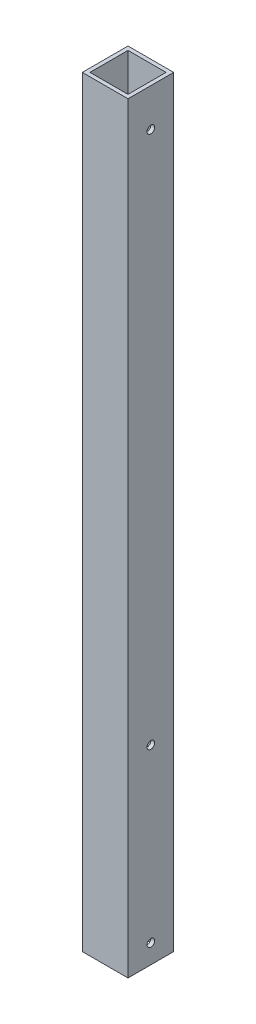
from build123d import *

# Parameters (mm, degrees)
SKETCH_1_W          = 12
SKETCH_1_H          = 12
SKETCH_1_W_2        = 8
SKETCH_1_H_2        = 8
EXTRUDE_1_DEPTH     = 200
CUT_EXTRUDE_1_DEPTH = 12
CUT_EXTRUDE_3_DEPTH = 200
SKETCH_6_R          = 1
CUT_EXTRUDE_4_DEPTH = 12
SKETCH_7_R          = 1
CUT_EXTRUDE_5_DEPTH = 12


with BuildPart() as part:
    # 草图1 → 凸台-拉伸1 (new body)
    with BuildSketch(Plane(origin=(0, 0, 0), x_dir=(1, 0, 0), z_dir=(0, 1, 0))):
        with Locations((6, 6)):
            Rectangle(SKETCH_1_W, SKETCH_1_H)
        with Locations((6, 6)):
            Rectangle(SKETCH_1_W_2, SKETCH_1_H_2, mode=Mode.SUBTRACT)
    extrude(amount=EXTRUDE_1_DEPTH)

    # 草图2 → 切除-拉伸1 (cut)
    with BuildSketch(Plane.ZY):
        with BuildLine():
            ThreePointArc((-7, 190), (-6, 189), (-5, 190))
            Line((-5, 190), (-7, 190))
        make_face()
        with BuildLine():
            Line((-7, 190), (-5, 190))
            ThreePointArc((-5, 190), (-6, 191), (-7, 190))
        make_face()
    extrude(amount=-CUT_EXTRUDE_1_DEPTH, mode=Mode.SUBTRACT)

    # 草图4 → 切除-拉伸3 (cut)
    with BuildSketch(Plane(origin=(0, 0, 0), x_dir=(-1, 0, 0), z_dir=(0, -1, 0))):
        Polygon((-11, 6), (-11, 1), (-1, 1), (-1, 11), (-11, 11), align=None)
    extrude(amount=-CUT_EXTRUDE_3_DEPTH, mode=Mode.SUBTRACT)

    # 草图6 → 切除-拉伸4 (cut)
    with BuildSketch(Plane(origin=(12, 0, 0), x_dir=(0, 0, -1), z_dir=(1, 0, 0))):
        with Locations((6, 5)):
            Circle(SKETCH_6_R)
    extrude(amount=-CUT_EXTRUDE_4_DEPTH, mode=Mode.SUBTRACT)

    # 草图7 → 切除-拉伸5 (cut)
    with BuildSketch(Plane.ZY):
        with Locations((-6, 50)):
            Circle(SKETCH_7_R)
    extrude(amount=-CUT_EXTRUDE_5_DEPTH, mode=Mode.SUBTRACT)


solid = part.part
